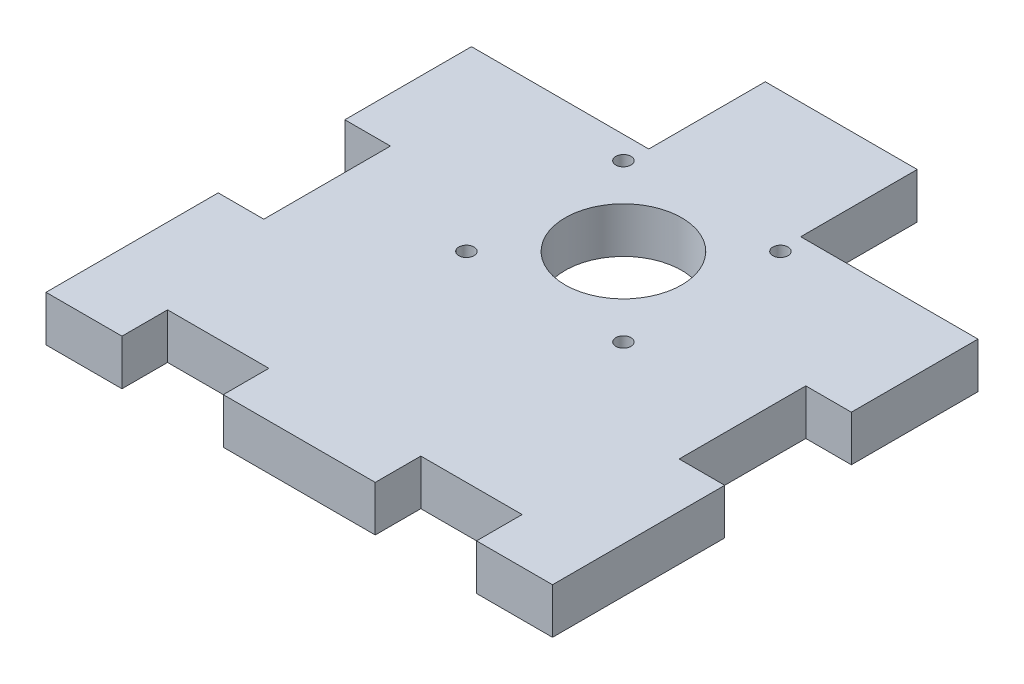
from build123d import *

# Parameters (mm, degrees)
BOSS_EXTRUDE1_DEPTH = 9
SKETCH4_R           = 11.5
SKETCH4_R_2         = 1.5
CUT_EXTRUDE1_DEPTH  = 80.001582263
SKETCH5_W           = 9
SKETCH5_H           = 25
CUT_EXTRUDE2_DEPTH  = 80.001582263
SKETCH6_W           = 15
SKETCH6_H           = 9
CUT_EXTRUDE3_DEPTH  = 80.001582263


with BuildPart() as part:
    # Sketch2 → Boss-Extrude1 (new body)
    with BuildSketch(Plane(origin=(0, 0, 0), x_dir=(1, 0, 0), z_dir=(0, 1, 0))):
        Polygon((-50, 46.5), (-50, -46.5), (-35, -46.5), (-35, -37.5), (-15, -37.5), (-15, -46.5), (15, -46.5), (15, -37.5), (35, -37.5), (35, -46.5), (50, -46.5), (50, 46.5), (35, 46.5), (35, 37.5), (15, 37.5), (15, 60.5), (-15, 60.5), (-15, 37.5), (-35, 37.5), (-35, 46.5), align=None)
    extrude(amount=BOSS_EXTRUDE1_DEPTH)

    # Sketch4 → Cut-Extrude1 (cut, through all)
    with BuildSketch(Plane(origin=(0, 9, 0), x_dir=(1, 0, 0), z_dir=(0, 1, 0))):
        with Locations(Location((0, 17.5, 0), (0, 0, 270))):
            Circle(SKETCH4_R)
        with Locations(Location((-15.5, 2, 0), (0, 0, 270))):
            Circle(SKETCH4_R_2)
        with Locations(Location((15.5, 2, 0), (0, 0, 90))):
            Circle(SKETCH4_R_2)
        with Locations(Location((15.5, 33, 0), (0, 0, 270))):
            Circle(SKETCH4_R_2)
        with Locations(Location((-15.5, 33, 0), (0, 0, 90))):
            Circle(SKETCH4_R_2)
    extrude(amount=-CUT_EXTRUDE1_DEPTH, mode=Mode.SUBTRACT)

    # Sketch5 → Cut-Extrude2 (cut, through all)
    with BuildSketch(Plane(origin=(0, 9, 0), x_dir=(1, 0, 0), z_dir=(0, 1, 0))):
        with Locations((-45.5, 0)):
            Rectangle(SKETCH5_W, SKETCH5_H)
        with Locations((45.5, 0)):
            Rectangle(SKETCH5_W, SKETCH5_H)
    extrude(amount=-CUT_EXTRUDE2_DEPTH, mode=Mode.SUBTRACT)

    # Sketch6 → Cut-Extrude3 (cut, through all)
    with BuildSketch(Plane(origin=(0, 9, 0), x_dir=(1, 0, 0), z_dir=(0, 1, 0))):
        with Locations((-42.5, 42)):
            Rectangle(SKETCH6_W, SKETCH6_H)
        with Locations((42.5, 42)):
            Rectangle(SKETCH6_W, SKETCH6_H)
    extrude(amount=-CUT_EXTRUDE3_DEPTH, mode=Mode.SUBTRACT)


solid = part.part
